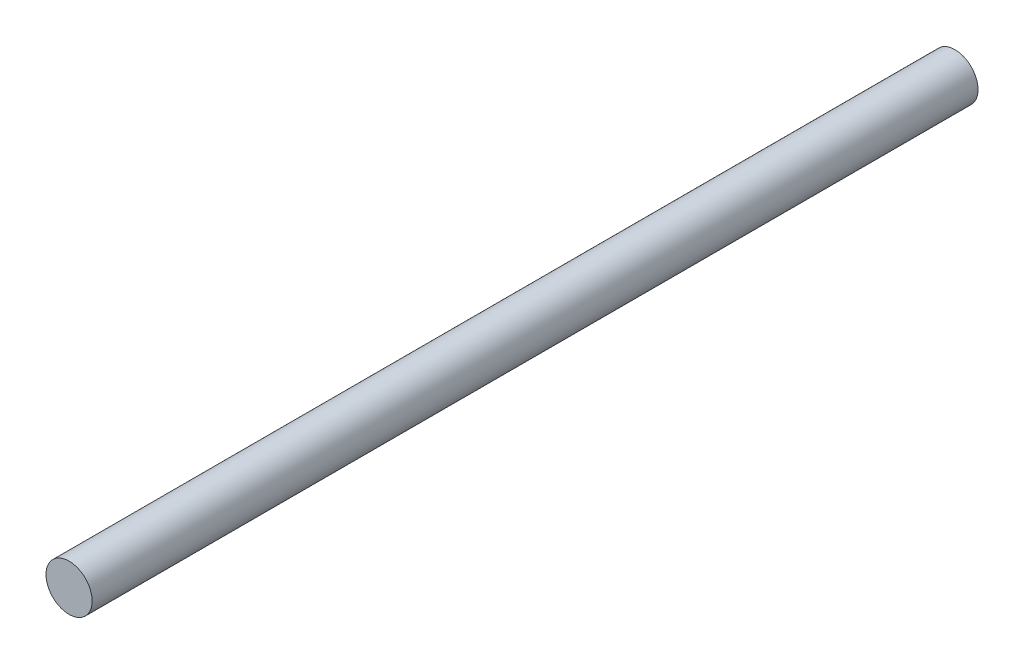
from build123d import *

# Parameters (mm, degrees)
SKETCH3_R           = 3.96875
BOSS_EXTRUDE1_DEPTH = 76.2


with BuildPart() as part:
    # Sketch3 → Boss-Extrude1 (new, symmetric)
    with BuildSketch(Plane.XY):
        with Locations(Location((0, 0, 0), (0, 0, 180))):
            Circle(SKETCH3_R)
    extrude(amount=BOSS_EXTRUDE1_DEPTH, both=True)


solid = part.part
